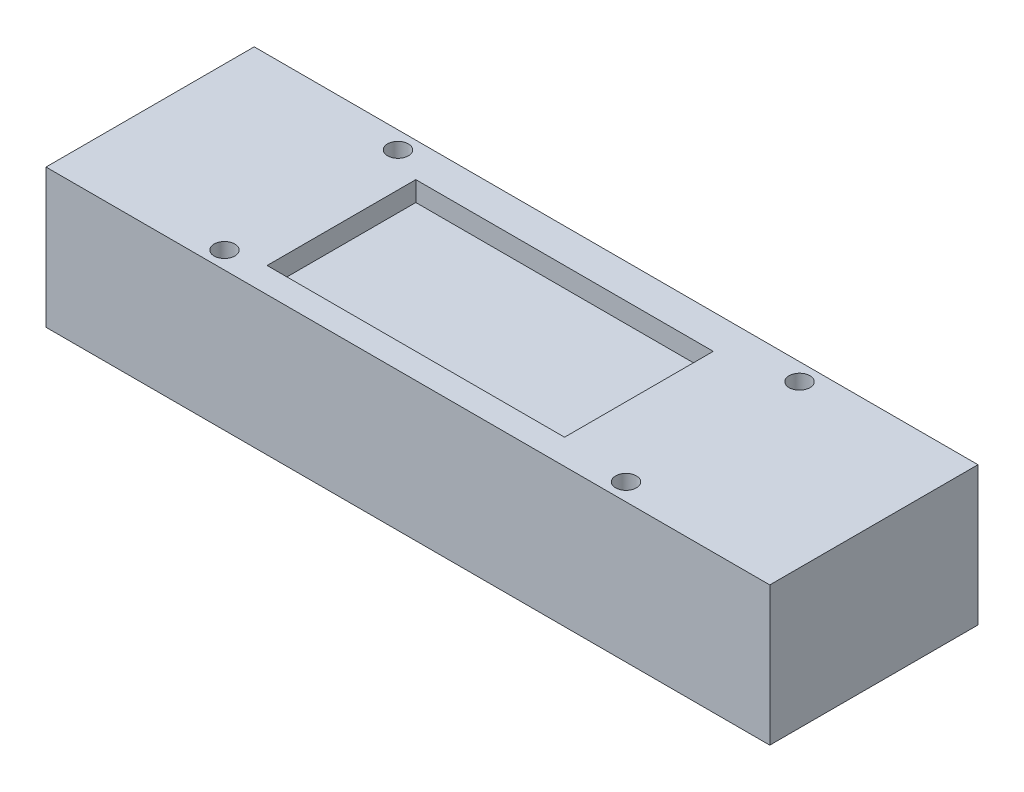
from build123d import *

# Parameters (mm, degrees)
SKETCH_1_W          = 73
SKETCH_1_H          = 21
SKETCH_1_R          = 1.05
EXTRUDE_1_DEPTH     = 14
SKETCH_2_W          = 30
SKETCH_2_H          = 15
CUT_EXTRUDE_1_DEPTH = 2


with BuildPart() as part:
    # 草图1 → 凸台-拉伸1 (new body)
    with BuildSketch(Plane(origin=(0, 0, 0), x_dir=(1, 0, 0), z_dir=(0, 1, 0))):
        Rectangle(SKETCH_1_W, SKETCH_1_H)
        with Locations(Location((-20.25, 8.75, 0), (0, 0, 270))):
            Circle(SKETCH_1_R, mode=Mode.SUBTRACT)
        with Locations(Location((20.25, 8.75, 0), (0, 0, 270))):
            Circle(SKETCH_1_R, mode=Mode.SUBTRACT)
        with Locations(Location((20.25, -8.75, 0), (0, 0, 270))):
            Circle(SKETCH_1_R, mode=Mode.SUBTRACT)
        with Locations(Location((-20.25, -8.75, 0), (0, 0, 270))):
            Circle(SKETCH_1_R, mode=Mode.SUBTRACT)
    extrude(amount=EXTRUDE_1_DEPTH)

    # 草图2 → 切除-拉伸1 (cut)
    with BuildSketch(Plane(origin=(0, 14, 0), x_dir=(1, 0, 0), z_dir=(0, 1, 0))):
        with Locations((-1.75, -0.45)):
            Rectangle(SKETCH_2_W, SKETCH_2_H)
    extrude(amount=-CUT_EXTRUDE_1_DEPTH, mode=Mode.SUBTRACT)


solid = part.part
